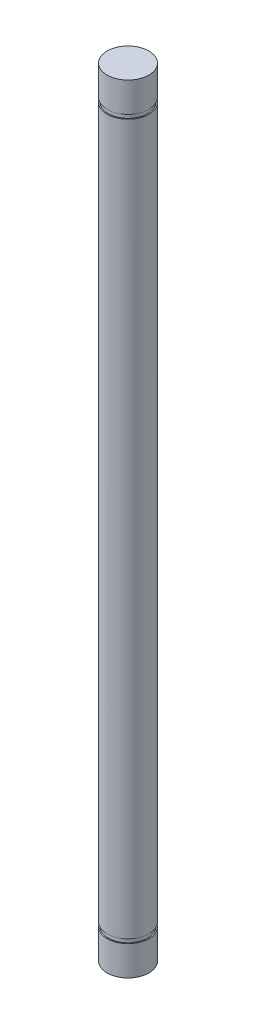
from build123d import *

# Parameters (mm, degrees)
SKETCH_1_R      = 4
EXTRUDE_1_DEPTH = 74.5
SKETCH_3_W      = 5
SKETCH_3_H      = 0.8


with BuildPart() as part:
    # 草图1 → 凸台-拉伸1 (new, symmetric)
    with BuildSketch(Plane(origin=(0, 0, 0), x_dir=(1, 0, 0), z_dir=(0, 1, 0))):
        with Locations(Location((0, 0, 0), (0, 0, 270))):
            Circle(SKETCH_1_R)
    extrude(amount=EXTRUDE_1_DEPTH, both=True)

    # 草图3 → 切除-旋转1 (revolve, cut)
    with BuildSketch(Plane(origin=(0, 0, 0), x_dir=(0, 0, -1), z_dir=(1, 0, 0)), mode=Mode.PRIVATE) as cut_revolve_1_sk:
        with Locations((6.3, 68.4)):
            Rectangle(SKETCH_3_W, SKETCH_3_H)
    cut_revolve_1 = revolve(cut_revolve_1_sk.sketch.rotate(Axis((0, 74.5, 0), (0, -1, 0)), 180), axis=Axis((0, 74.5, 0), (0, -1, 0)), mode=Mode.SUBTRACT)

    # 镜向1: 切除-旋转1 across plane
    add(cut_revolve_1.mirror(Plane.ZX), mode=Mode.SUBTRACT)


solid = part.part
